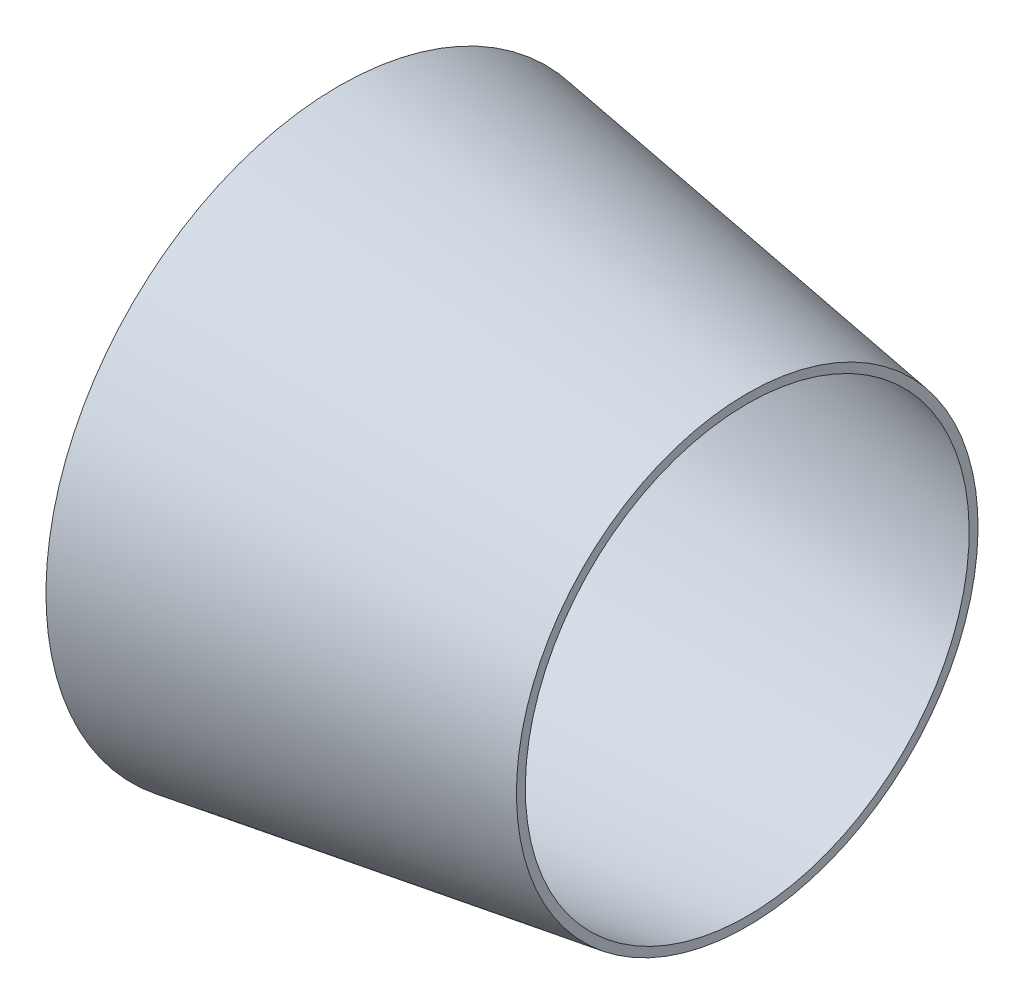
from build123d import *

# Parameters (mm, degrees)
REVOLVE1_ANGLE = 359.999999589


with BuildPart() as part:
    # Sketch1 → Revolve1 (revolve)
    with BuildSketch(Plane.XY):
        Polygon((3200, 1550), (3200, 1650), (5500, 1300), (5500, 1250), align=None)
    revolve(axis=Axis((0, 0, 0), (1, 0, 0)), revolution_arc=REVOLVE1_ANGLE)


solid = part.part
